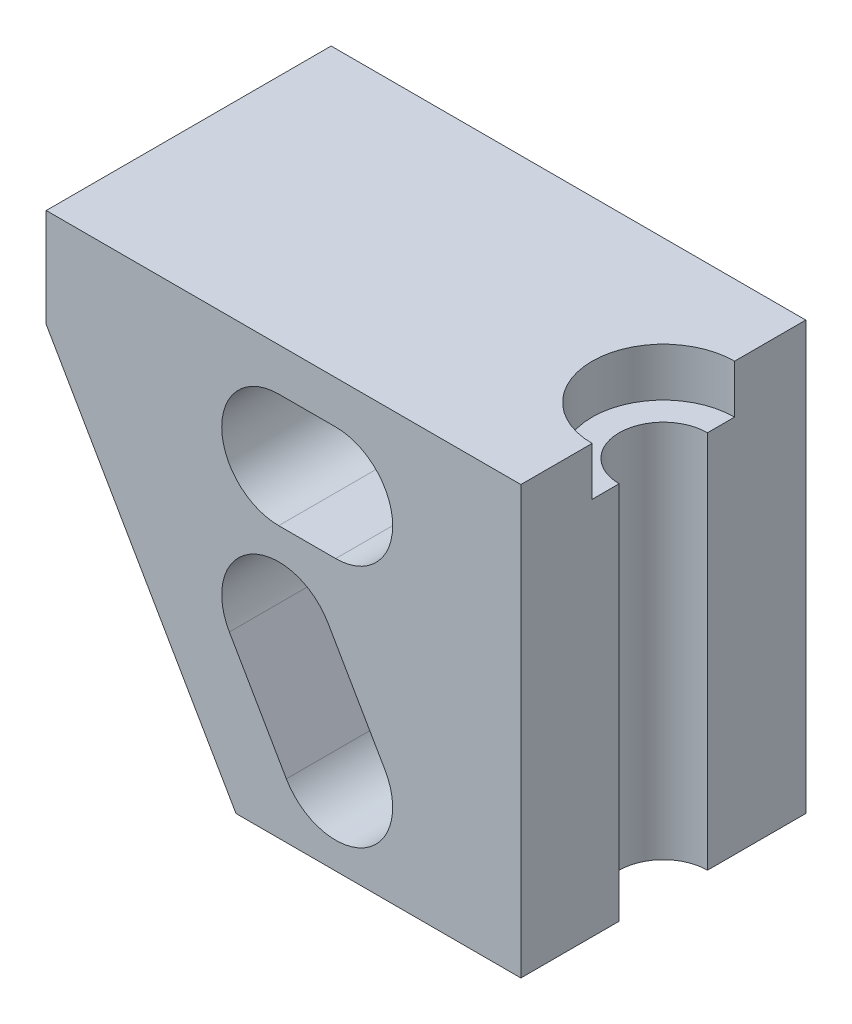
from build123d import *

# Parameters (mm, degrees)
EXTRUDE_1_DEPTH     = 10
SKETCH_2_R          = 1.55
CUT_EXTRUDE_1_DEPTH = 26.946195882
SKETCH_3_R          = 2.5
CUT_EXTRUDE_2_DEPTH = 1.7
CUT_EXTRUDE_3_DEPTH = 26.946195882


with BuildPart() as part:
    # 스케치1 → 보스-돌출1 (new body)
    with BuildSketch(Plane.XY):
        Polygon((-10, 0), (0, 0), (0, 15), (-18.660254038, 15), align=None)
        with BuildLine():
            ThreePointArc((-10.232050808, 5.401923789), (-9.5, 8.133974596), (-6.767949192, 7.401923789))
            Line((-6.767949192, 7.401923789), (-4.767949192, 3.937822174))
            ThreePointArc((-4.767949192, 3.937822174), (-4.568148347, 3.455460264), (-4.5, 2.937822174))
            ThreePointArc((-4.5, 2.937822174), (-5.98236191, 1.005970521), (-8.232050808, 1.937822174))
            Line((-8.232050808, 1.937822174), (-10.232050808, 5.401923789))
        make_face(mode=Mode.SUBTRACT)
        with BuildLine():
            ThreePointArc((-8.5, 9.5), (-10.5, 11.5), (-8.5, 13.5))
            Line((-8.5, 13.5), (-6.5, 13.5))
            ThreePointArc((-6.5, 13.5), (-5.085786438, 12.914213562), (-4.5, 11.5))
            ThreePointArc((-4.5, 11.5), (-5.085786438, 10.085786438), (-6.5, 9.5))
            Line((-6.5, 9.5), (-8.5, 9.5))
        make_face(mode=Mode.SUBTRACT)
    extrude(amount=EXTRUDE_1_DEPTH)

    # 스케치2 → 컷-돌출1 (cut, through all)
    with BuildSketch(Plane.XZ):
        with Locations((0, 5)):
            Circle(SKETCH_2_R)
    extrude(amount=-CUT_EXTRUDE_1_DEPTH, mode=Mode.SUBTRACT)

    # 스케치3 → 컷-돌출2 (cut)
    with BuildSketch(Plane(origin=(0, 15, 0), x_dir=(1, 0, 0), z_dir=(0, 1, 0))):
        with Locations((0, -5)):
            Circle(SKETCH_3_R)
    extrude(amount=-CUT_EXTRUDE_2_DEPTH, mode=Mode.SUBTRACT)

    # 스케치4 → 컷-돌출3 (cut, through all)
    with BuildSketch(Plane.XY.offset(10)):
        Polygon((-18.660254038, 15), (-16.660254038, 15), (-16.660254038, 11.535898385), align=None)
    extrude(amount=-CUT_EXTRUDE_3_DEPTH, mode=Mode.SUBTRACT)


solid = part.part
